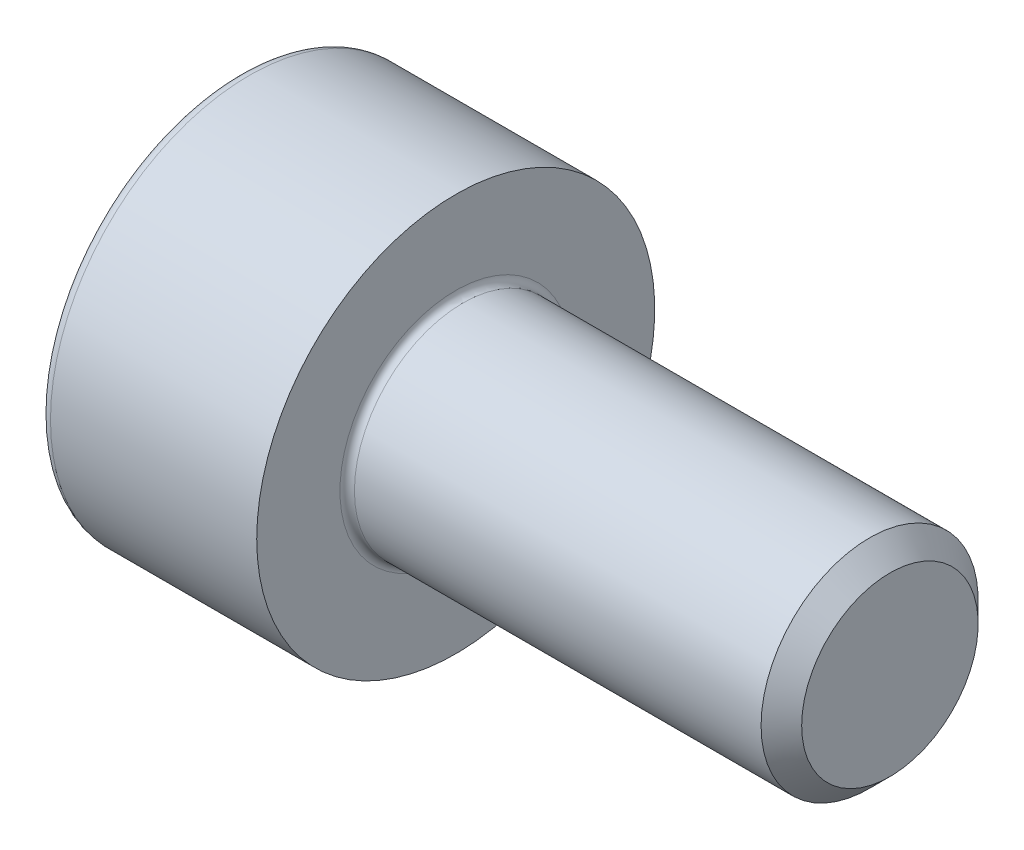
from build123d import *

# Parameters (mm, degrees)
FILLET1_R   = 0.1
FILLET2_R   = 0.15
HEX_2_DEPTH = 1.3


with BuildPart() as part:
    # BodySke → Base-Revolve (revolve)
    with BuildSketch(Plane.XY, mode=Mode.PRIVATE) as base_revolve_sk:
        Polygon((0, 0), (0, 2.75), (3, 2.75), (3, 1.5), (8.7195, 1.5), (9, 1.2195), (9, 0), align=None)
    revolve(base_revolve_sk.sketch.rotate(Axis((-31.75, 0, 0), (1, 0, 0)), 90), axis=Axis((-31.75, 0, 0), (1, 0, 0)))

    # Fillet1
    fillet1_edges = [part.edges().sort_by_distance(p)[0] for p in [
        (3, 0, -1.5),
    ]]
    fillet(fillet1_edges, radius=FILLET1_R)

    # Fillet2
    fillet2_edges = [part.edges().sort_by_distance(p)[0] for p in [
        (0, 0, -2.75),
    ]]
    fillet(fillet2_edges, radius=FILLET2_R)

    # Sketch2 → Hex-PreBroach (revolve, cut)
    with BuildSketch(Plane.XY, mode=Mode.PRIVATE) as hex_prebroach_sk:
        Polygon((0, 1.28), (1.3, 1.28), (2.039008345, 0), (0, 0), align=None)
    revolve(hex_prebroach_sk.sketch.rotate(Axis((0, 0, 0), (1, 0, 0)), 90), axis=Axis((0, 0, 0), (1, 0, 0)), mode=Mode.SUBTRACT)

    # Sketch3 → Hex 2 (cut)
    with BuildSketch(Plane(origin=(0, 0, 0), x_dir=(0, 0.500000000000001, 0.866025403784438), z_dir=(-1, 0, 0))):
        Polygon((0.739008345, 1.28), (-0.739008345, 1.28), (-1.478016689, 0), (-0.739008345, -1.28), (0.739008345, -1.28), (1.478016689, 0), align=None)
    extrude(amount=-HEX_2_DEPTH, mode=Mode.SUBTRACT)


solid = part.part
